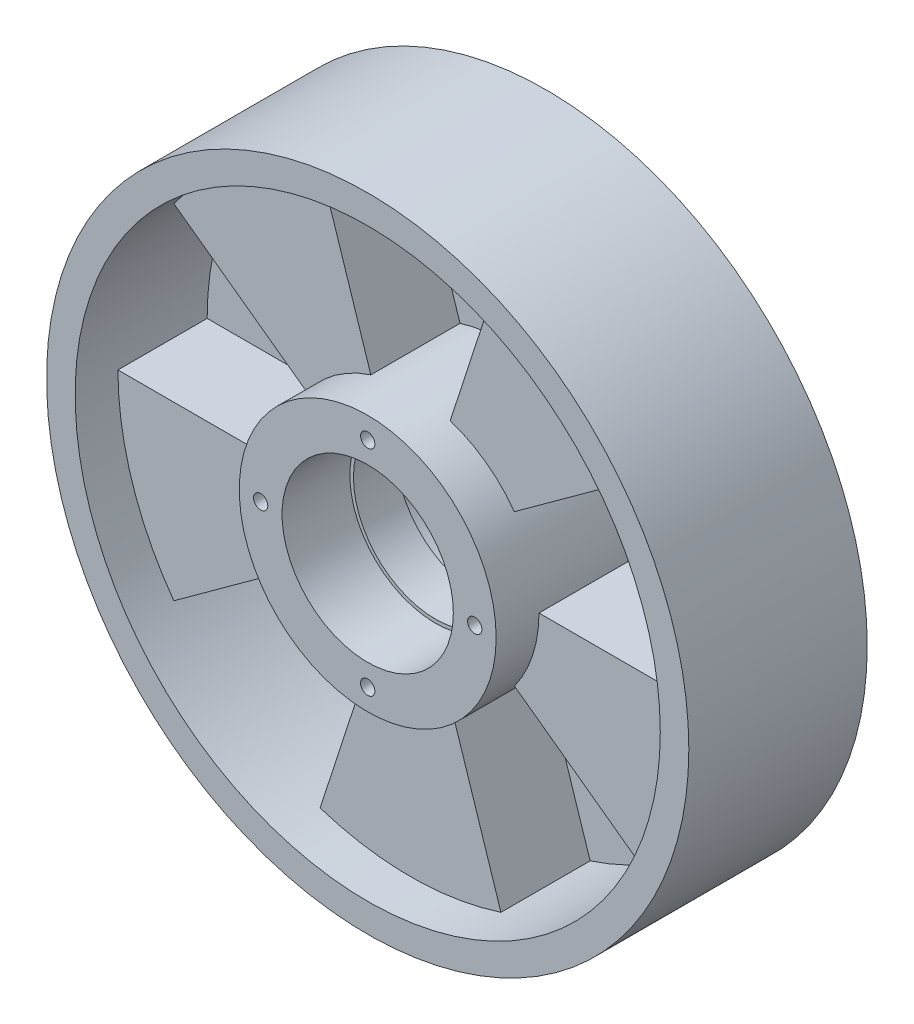
from build123d import *
from build123d.topology import SkipClean

# Parameters (mm, degrees)
SKETCH1_R           = 90
BOSS_EXTRUDE1_DEPTH = 25
SKETCH3_R           = 24
CUT_EXTRUDE2_DEPTH  = 19
CUT_EXTRUDE3_START  = -19
SKETCH4_R           = 24
CUT_EXTRUDE3_DEPTH  = 19
SKETCH5_R           = 23
CUT_EXTRUDE4_DEPTH  = 12
SKETCH6_R           = 82
SKETCH6_R_2         = 36
CUT_EXTRUDE7_DEPTH  = 12
CUT_EXTRUDE8_START  = -12
SKETCH8_R           = 82
SKETCH8_R_2         = 36
CUT_EXTRUDE8_DEPTH  = 12
CUT_EXTRUDE10_START = -25
CUT_EXTRUDE10_DEPTH = 25
CUT_EXTRUDE11_DEPTH = 25
SKETCH13_R          = 2
CUT_EXTRUDE12_DEPTH = 137.747943312


with BuildPart() as part:
    # Sketch1 → Boss-Extrude1 (new, symmetric)
    with BuildSketch(Plane.XY):
        Circle(SKETCH1_R)
    extrude(amount=BOSS_EXTRUDE1_DEPTH, both=True)

    # Sketch3 → Cut-Extrude2 (cut)
    with BuildSketch(Plane.XY.offset(25)):
        Circle(SKETCH3_R)
    extrude(amount=-CUT_EXTRUDE2_DEPTH, mode=Mode.SUBTRACT)

    # Sketch4 → Cut-Extrude3 (cut)
    with BuildSketch(Plane(origin=(0, 0, -25), x_dir=(-1, 0, 0), z_dir=(0, 0, -1)).offset(CUT_EXTRUDE3_START)):
        with Locations(Location((0, 0, 0), (0, 0, 180))):
            Circle(SKETCH4_R)
    extrude(amount=CUT_EXTRUDE3_DEPTH, mode=Mode.SUBTRACT)

    # Sketch5 → Cut-Extrude4 (cut)
    with BuildSketch(Plane(origin=(0, 0, -6), x_dir=(-1, 0, 0), z_dir=(0, 0, -1))):
        Circle(SKETCH5_R)
    extrude(amount=-CUT_EXTRUDE4_DEPTH, mode=Mode.SUBTRACT)

    # Sketch6 → Cut-Extrude7 (cut)
    with BuildSketch(Plane(origin=(0, 0, -25), x_dir=(-1, 0, 0), z_dir=(0, 0, -1))):
        Circle(SKETCH6_R)
        Circle(SKETCH6_R_2, mode=Mode.SUBTRACT)
    extrude(amount=-CUT_EXTRUDE7_DEPTH, mode=Mode.SUBTRACT)

    # Sketch8 → Cut-Extrude8 (cut)
    with BuildSketch(Plane.XY.offset(25).offset(CUT_EXTRUDE8_START)):
        with Locations(Location((0, 0, 0), (0, 0, 180))):
            Circle(SKETCH8_R)
        with Locations(Location((0, 0, 0), (0, 0, 180))):
            Circle(SKETCH8_R_2, mode=Mode.SUBTRACT)
    extrude(amount=CUT_EXTRUDE8_DEPTH, mode=Mode.SUBTRACT)

    # Sketch11 → Cut-Extrude10 (cut)
    with SkipClean():  # the faces are left unmerged after this step: merging them gives an invalid solid
        with BuildSketch(Plane.XY.offset(13).offset(CUT_EXTRUDE10_START)):
            with BuildLine():
                Line((11.124611797, 34.238034587), (25.339393539, 77.986634336))
                ThreePointArc((25.339393539, 77.986634336), (0, 82), (-25.339393539, 77.986634336))
                Line((-25.339393539, 77.986634336), (-11.124611798, 34.238034587))
                ThreePointArc((-11.124611798, 34.238034587), (0, 36), (11.124611797, 34.238034587))
            make_face()
            with BuildLine():
                Line((29.124611798, 21.160269083), (66.339393539, 48.198390688))
                ThreePointArc((66.339393539, 48.198390688), (77.986634336, 25.339393539), (82, 0))
                Line((82, 0), (36, 0))
                ThreePointArc((36, 0), (34.238034587, 11.124611797), (29.124611798, 21.160269083))
            make_face()
            with BuildLine():
                Line((29.124611798, -21.160269083), (66.339393539, -48.198390688))
                ThreePointArc((66.339393539, -48.198390688), (48.198390688, -66.339393539), (25.339393539, -77.986634336))
                Line((25.339393539, -77.986634336), (11.124611797, -34.238034587))
                ThreePointArc((11.124611797, -34.238034587), (21.160269083, -29.124611798), (29.124611798, -21.160269083))
            make_face()
            with BuildLine():
                Line((-11.124611797, -34.238034587), (-25.339393539, -77.986634336))
                ThreePointArc((-25.339393539, -77.986634336), (-48.198390688, -66.339393539), (-66.339393539, -48.198390688))
                Line((-66.339393539, -48.198390688), (-29.124611798, -21.160269083))
                ThreePointArc((-29.124611798, -21.160269083), (-21.160269083, -29.124611798), (-11.124611797, -34.238034587))
            make_face()
            with BuildLine():
                Line((-36, 0), (-82, 0))
                ThreePointArc((-82, 0), (-77.986634336, 25.339393539), (-66.339393539, 48.198390688))
                Line((-66.339393539, 48.198390688), (-29.124611798, 21.160269083))
                ThreePointArc((-29.124611798, 21.160269083), (-34.238034587, 11.124611797), (-36, 0))
            make_face()
        extrude(amount=CUT_EXTRUDE10_DEPTH, mode=Mode.SUBTRACT)

    # Sketch12 → Cut-Extrude11 (cut)
    with SkipClean():  # the faces are left unmerged after this step: merging them gives an invalid solid
        with BuildSketch(Plane(origin=(0, 0, -13), x_dir=(-1, 0, 0), z_dir=(0, 0, -1))):
            with BuildLine():
                ThreePointArc((-28.750878362, 21.665340833), (-21.160269083, 29.124611797), (-11.72045356, 34.038668722))
                Line((-11.72045356, 34.038668722), (-26.696588665, 77.532523199))
                ThreePointArc((-26.696588665, 77.532523199), (-48.198390688, 66.339393539), (-65.488111824, 49.348831898))
                Line((-65.488111824, 49.348831898), (-28.750878362, 21.665340833))
            make_face()
            with BuildLine():
                Line((26.696588665, 77.532523199), (11.72045356, 34.038668722))
                ThreePointArc((11.72045356, 34.038668722), (21.160269083, 29.124611797), (28.750878362, 21.665340833))
                Line((28.750878362, 21.665340833), (65.488111824, 49.348831898))
                ThreePointArc((65.488111824, 49.348831898), (48.198390688, 66.339393539), (26.696588665, 77.532523199))
            make_face()
            with BuildLine():
                Line((81.987511003, -1.431097328), (35.994517026, -0.628286632))
                ThreePointArc((35.994517026, -0.628286632), (34.238034587, -11.124611797), (29.489473594, -20.648751709))
                Line((29.489473594, -20.648751709), (67.170467632, -47.033267781))
                ThreePointArc((67.170467632, -47.033267781), (77.986634336, -25.339393539), (81.987511003, -1.431097328))
            make_face()
            with BuildLine():
                ThreePointArc((-29.489473594, -20.648751709), (-34.238034587, -11.124611797), (-35.994517026, -0.628286632))
                Line((-35.994517026, -0.628286632), (-81.987511003, -1.431097328))
                ThreePointArc((-81.987511003, -1.431097328), (-77.986634336, -25.339393539), (-67.170467632, -47.033267781))
                Line((-67.170467632, -47.033267781), (-29.489473594, -20.648751709))
            make_face()
            with BuildLine():
                Line((23.974479787, -78.416989989), (10.52538137, -34.426971215))
                ThreePointArc((10.52538137, -34.426971215), (0, -36), (-10.52538137, -34.426971215))
                Line((-10.52538137, -34.426971215), (-23.974479787, -78.416989989))
                ThreePointArc((-23.974479787, -78.416989989), (0, -82), (23.974479787, -78.416989989))
            make_face()
        extrude(amount=-CUT_EXTRUDE11_DEPTH, mode=Mode.SUBTRACT)

    # Sketch13 → Cut-Extrude12 (cut, through all)
    with SkipClean():  # the faces are left unmerged after this step: merging them gives an invalid solid
        with BuildSketch(Plane(origin=(0, 0, -25), x_dir=(-1, 0, 0), z_dir=(0, 0, -1))):
            with Locations((0, 30)):
                Circle(SKETCH13_R)
            with Locations((30, 0)):
                Circle(SKETCH13_R)
            with Locations((0, -30)):
                Circle(SKETCH13_R)
            with Locations((-30, 0)):
                Circle(SKETCH13_R)
        extrude(amount=-CUT_EXTRUDE12_DEPTH, mode=Mode.SUBTRACT)


solid = part.part
